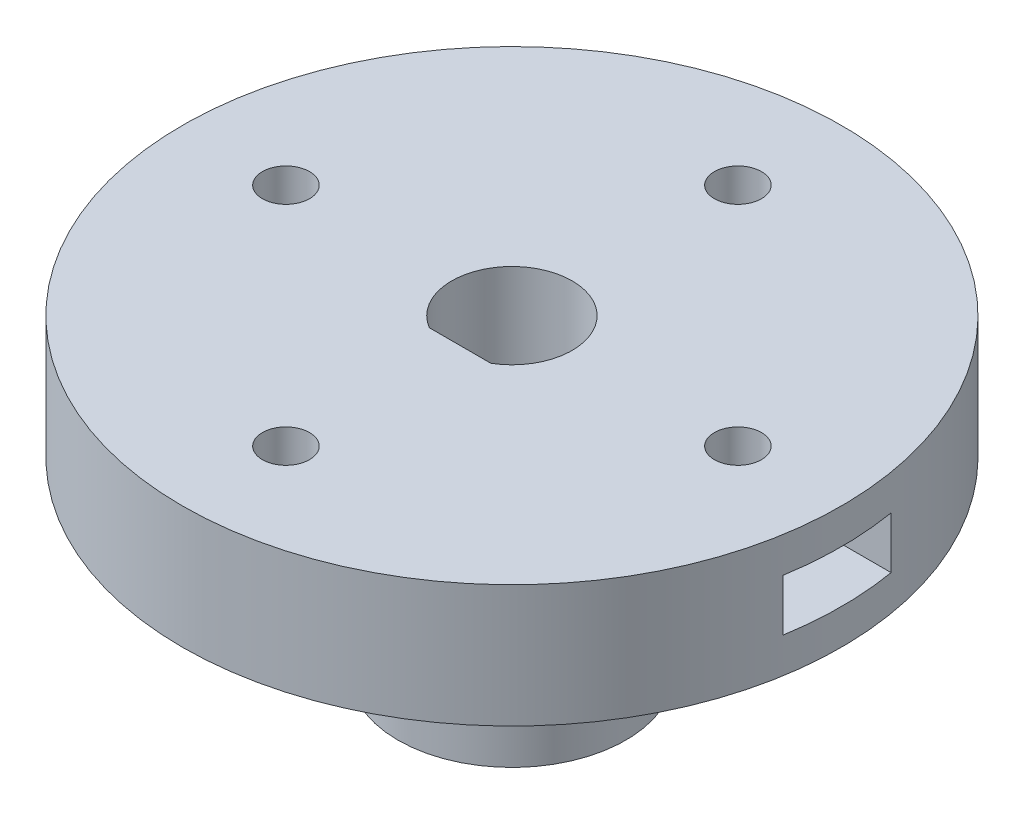
from build123d import *

# Parameters (mm, degrees)
SKETCH1_R                      = 6.05
SKETCH1_R_2                    = 3.05
BOSS_EXTRUDE1_DEPTH            = 10
SKETCH2_R                      = 17.5
BOSS_EXTRUDE2_DEPTH            = 6.5
CUT_EXTRUDE1_REACH             = 28.693
SKETCH3_R                      = 1.25
CUT_EXTRUDE2_DEPTH             = 30.744747435
CUT_EXTRUDE2_DEPTH_BACK        = 30.744747435
SKETCH4_R                      = 1.5
CUT_EXTRUDE3_REACH             = 28.693
SKETCH6_R                      = 3.2
CUT_EXTRUDE3_DIRECTION_2_REACH = 28.693
BOSS_EXTRUDE3_DEPTH            = 16.5
SKETCH8_W                      = 5.75
SKETCH8_H                      = 2.75
CUT_EXTRUDE4_DEPTH             = 5
CUT_EXTRUDE5_DEPTH             = 2.75


with BuildPart() as part:
    # Sketch1 → Boss-Extrude1 (new body)
    with BuildSketch(Plane(origin=(0, 0, 0), x_dir=(1, 0, 0), z_dir=(0, 1, 0))):
        with Locations(Location((0, 0, 0), (0, 0, 270))):
            Circle(SKETCH1_R)
        with Locations(Location((0, 0, 0), (0, 0, 270))):
            Circle(SKETCH1_R_2, mode=Mode.SUBTRACT)
    extrude(amount=BOSS_EXTRUDE1_DEPTH)

    # Sketch2 → Boss-Extrude2 (add)
    with BuildSketch(Plane(origin=(0, 10, 0), x_dir=(1, 0, 0), z_dir=(0, 1, 0))):
        with Locations(Location((0, 0, 0), (0, 0, 90))):
            Circle(SKETCH2_R)
    extrude(amount=BOSS_EXTRUDE2_DEPTH)

    # Sketch3 → Cut-Extrude1 (cut, up to next)
    with BuildSketch(Plane.XZ.offset(-10), mode=Mode.PRIVATE) as cut_extrude1_sk1:
        with Locations(Location((12, 0, 0), (0, 0, 270))):
            Circle(SKETCH3_R)
    cut_extrude1_tool1 = extrude(cut_extrude1_sk1.sketch, amount=-CUT_EXTRUDE1_REACH, mode=Mode.PRIVATE) & part.part
    # Sketch3 → Cut-Extrude1 (cut, up to next)
    with BuildSketch(Plane.XZ.offset(-10), mode=Mode.PRIVATE) as cut_extrude1_sk2:
        with Locations(Location((0, -12, 0), (0, 0, 270))):
            Circle(SKETCH3_R)
    cut_extrude1_tool2 = extrude(cut_extrude1_sk2.sketch, amount=-CUT_EXTRUDE1_REACH, mode=Mode.PRIVATE) & part.part
    # Sketch3 → Cut-Extrude1 (cut, up to next)
    with BuildSketch(Plane.XZ.offset(-10), mode=Mode.PRIVATE) as cut_extrude1_sk3:
        with Locations(Location((-12, 0, 0), (0, 0, 270))):
            Circle(SKETCH3_R)
    cut_extrude1_tool3 = extrude(cut_extrude1_sk3.sketch, amount=-CUT_EXTRUDE1_REACH, mode=Mode.PRIVATE) & part.part
    # Sketch3 → Cut-Extrude1 (cut, up to next)
    with BuildSketch(Plane.XZ.offset(-10), mode=Mode.PRIVATE) as cut_extrude1_sk4:
        with Locations(Location((0, 12, 0), (0, 0, 270))):
            Circle(SKETCH3_R)
    cut_extrude1_tool4 = extrude(cut_extrude1_sk4.sketch, amount=-CUT_EXTRUDE1_REACH, mode=Mode.PRIVATE) & part.part
    add(cut_extrude1_tool1.solids().sort_by_distance((12, 10, 0))[0], mode=Mode.SUBTRACT)
    add(cut_extrude1_tool2.solids().sort_by_distance((0, 10, -12))[0], mode=Mode.SUBTRACT)
    add(cut_extrude1_tool3.solids().sort_by_distance((-12, 10, 0))[0], mode=Mode.SUBTRACT)
    add(cut_extrude1_tool4.solids().sort_by_distance((0, 10, 12))[0], mode=Mode.SUBTRACT)

    # Sketch4 → Cut-Extrude2 (cut, two sides: drawn at the far end of the back side and taken through both)
    with BuildSketch(Plane.XY.offset(-CUT_EXTRUDE2_DEPTH_BACK)):
        with Locations((0, 4.916404418)):
            Circle(SKETCH4_R)
    extrude(amount=CUT_EXTRUDE2_DEPTH + CUT_EXTRUDE2_DEPTH_BACK, mode=Mode.SUBTRACT)

    # Sketch6 → Cut-Extrude3 (cut, up to next)
    with BuildSketch(Plane(origin=(0, 10, 0), x_dir=(-1, 0, 0), z_dir=(0, -1, 0)), mode=Mode.PRIVATE) as cut_extrude3_sk1:
        with Locations(Location((0, 0, 0), (0, 0, 270))):
            Circle(SKETCH6_R)
    cut_extrude3_tool1 = extrude(cut_extrude3_sk1.sketch, amount=-CUT_EXTRUDE3_REACH, mode=Mode.PRIVATE) & part.part
    add(cut_extrude3_tool1.solids().sort_by_distance((0, 10, 0))[0], mode=Mode.SUBTRACT)

    # Sketch6 → Cut-Extrude3 direction 2 (cut, up to next)
    with BuildSketch(Plane(origin=(0, 10, 0), x_dir=(-1, 0, 0), z_dir=(0, -1, 0)), mode=Mode.PRIVATE) as cut_extrude3_direction_2_sk1:
        with Locations(Location((0, 0, 0), (0, 0, 270))):
            Circle(SKETCH6_R)
    cut_extrude3_direction_2_tool1 = extrude(cut_extrude3_direction_2_sk1.sketch, amount=CUT_EXTRUDE3_DIRECTION_2_REACH, mode=Mode.PRIVATE) & part.part
    add(cut_extrude3_direction_2_tool1.solids().sort_by_distance((0, 10, 0))[0], mode=Mode.SUBTRACT)

    # Sketch7 → Boss-Extrude3 (add)
    with BuildSketch(Plane.XZ):
        with BuildLine():
            Line((-1.636306817, 2.75), (1.636306817, 2.75))
            ThreePointArc((1.636306817, 2.75), (0, 3.2), (-1.636306817, 2.75))
        make_face()
    extrude(amount=-BOSS_EXTRUDE3_DEPTH)

    # Sketch8 → Cut-Extrude4 (cut)
    with BuildSketch(Plane(origin=(17.5, 0, 0), x_dir=(0, 0, -1), z_dir=(1, 0, 0))):
        with Locations((0, 13.25)):
            Rectangle(SKETCH8_W, SKETCH8_H)
    cut_extrude4 = extrude(amount=-CUT_EXTRUDE4_DEPTH, mode=Mode.SUBTRACT)

    # Sketch9 → Cut-Extrude5 (cut)
    with BuildSketch(Plane.XZ.offset(-14.625)):
        Polygon((15.319764048, 0), (13.659882024, 2.875), (10.340117976, 2.875), (8.680235952, 0), (10.340117976, -2.875), (13.659882024, -2.875), align=None)
    cut_extrude5 = extrude(amount=CUT_EXTRUDE5_DEPTH, mode=Mode.SUBTRACT)

    # Mirror1: Cut-Extrude4, Cut-Extrude5 across plane
    add(cut_extrude4.mirror(Plane(origin=(0, 0, 0), x_dir=(0, 0, 1), z_dir=(1, 0, 0))), mode=Mode.SUBTRACT)
    add(cut_extrude5.mirror(Plane(origin=(0, 0, 0), x_dir=(0, 0, 1), z_dir=(1, 0, 0))), mode=Mode.SUBTRACT)


solid = part.part
